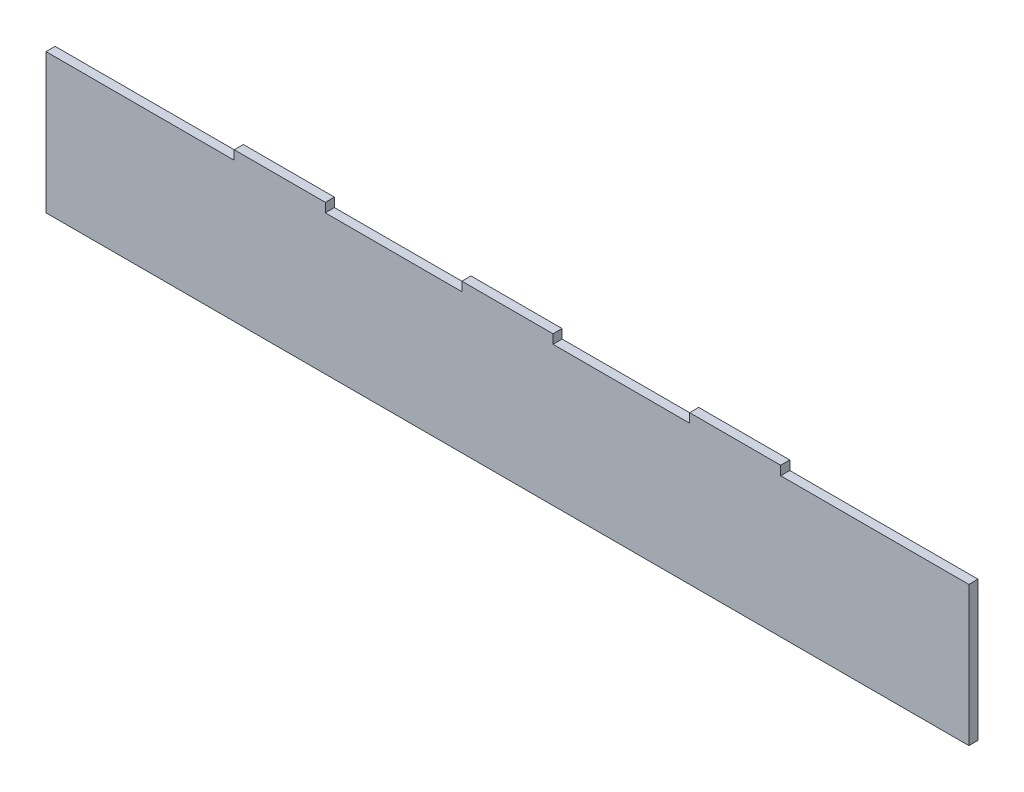
from build123d import *

# Parameters (mm, degrees)
BOSS_EXTRU_1_DEPTH = 3


with BuildPart() as part:
    # Esquisse1 → Boss.-Extru.1 (new body)
    with BuildSketch(Plane.XY):
        Polygon((152, -23), (-152, -23), (-152, 23), (-90, 23), (-90, 26), (-60, 26), (-60, 23), (-15, 23), (-15, 26), (15, 26), (15, 23), (60, 23), (60, 26), (90, 26), (90, 23), (152, 23), align=None)
    extrude(amount=BOSS_EXTRU_1_DEPTH)


solid = part.part
